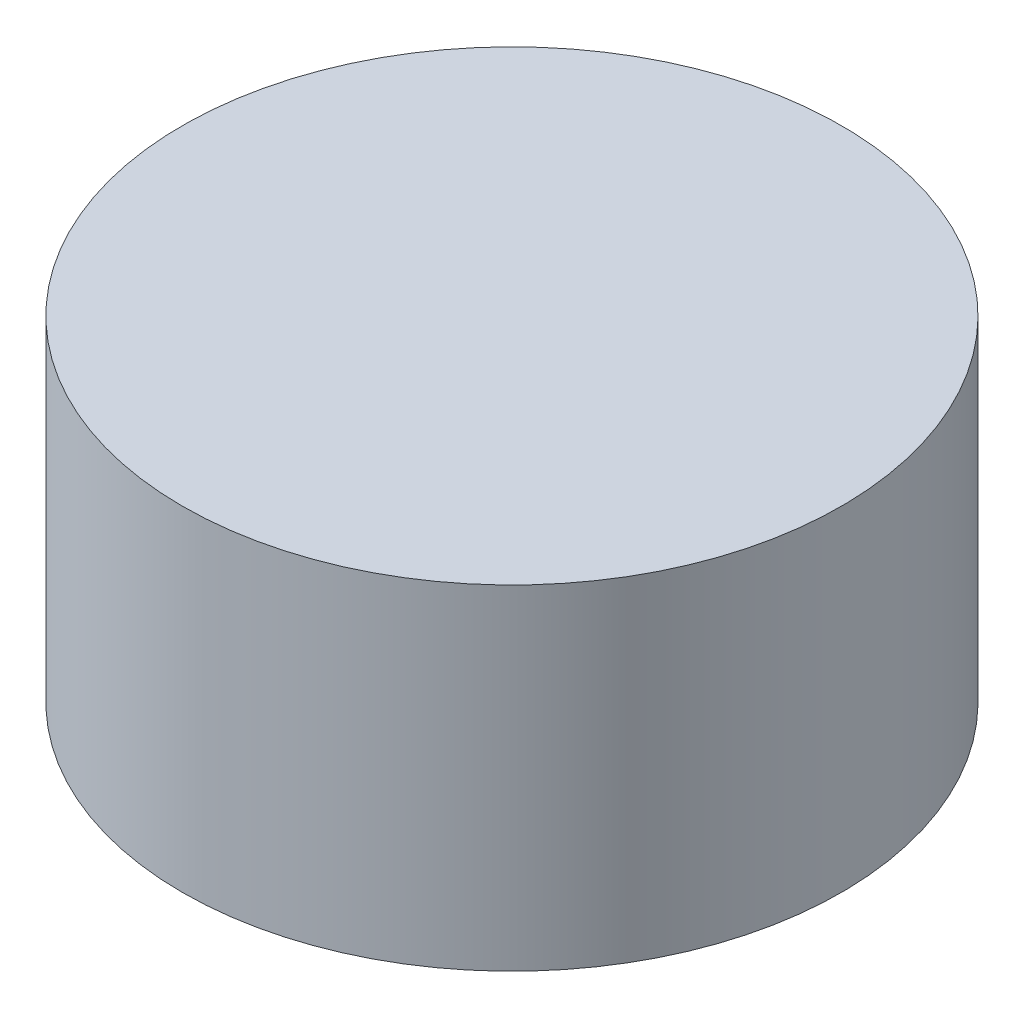
from build123d import *

# Parameters (mm, degrees)
SKETCH1_R           = 78.275375669
BOSS_EXTRUDE1_DEPTH = 79.449415921


with BuildPart() as part:
    # Sketch1 → Boss-Extrude1 (new body)
    with BuildSketch(Plane(origin=(0, 0, 0), x_dir=(1, 0, 0), z_dir=(0, 1, 0))):
        with Locations(Location((0, 0, 0), (0, 0, 270))):
            Circle(SKETCH1_R)
    extrude(amount=BOSS_EXTRUDE1_DEPTH)


solid = part.part
